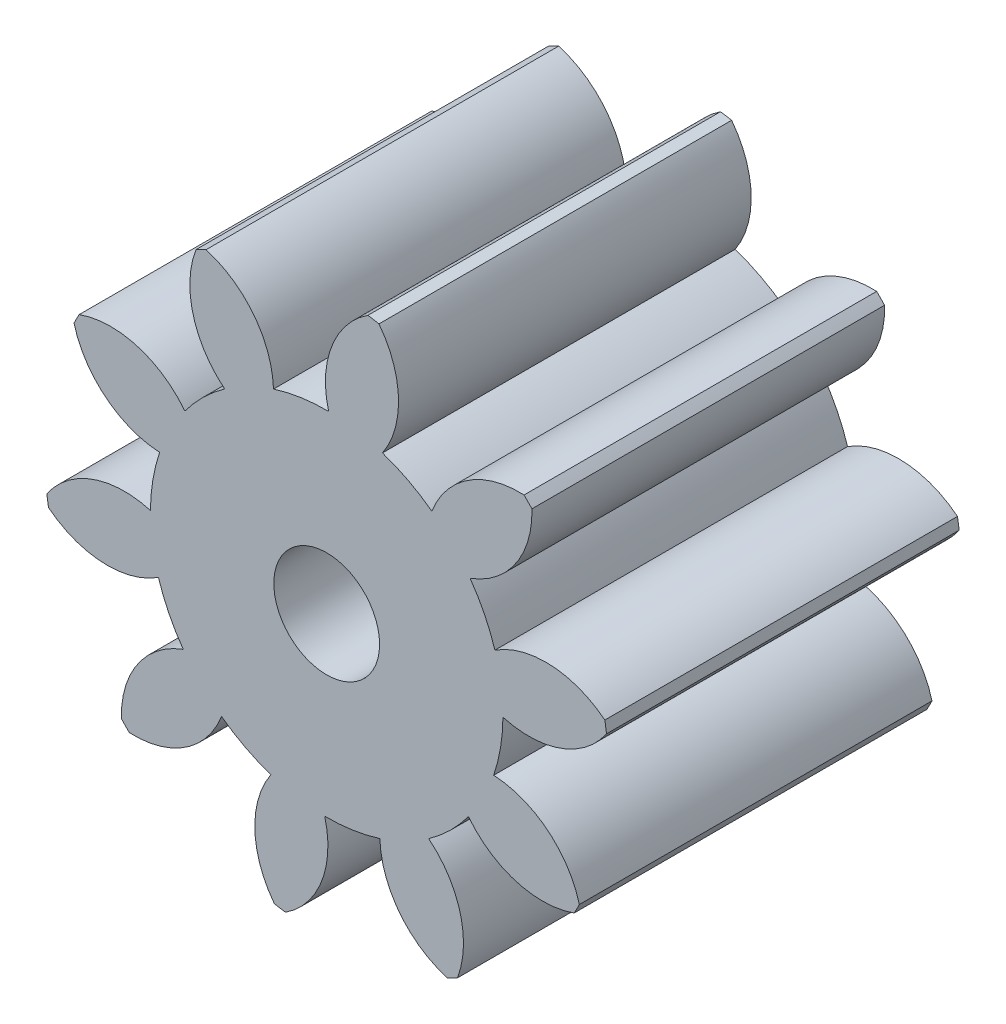
from build123d import *

# Parameters (mm, degrees)
SKETCH1_R           = 6
SKETCH1_R_2         = 0.9
BOSS_EXTRUDE1_DEPTH = 3
SKETCH2_R           = 6
CUT_EXTRUDE1_DEPTH  = 11.392304845


with BuildPart() as part:
    # Sketch1 → Boss-Extrude1 (new, symmetric)
    with BuildSketch(Plane.XY):
        Circle(SKETCH1_R)
        Circle(SKETCH1_R_2, mode=Mode.SUBTRACT)
    extrude(amount=BOSS_EXTRUDE1_DEPTH, both=True)

    # Sketch2 → Cut-Extrude1 (cut, through all)
    with BuildSketch(Plane.XY.offset(3)):
        Circle(SKETCH2_R)
        with BuildLine():
            ThreePointArc((-0.904303163, 2.859411966), (-1.23929318, 3.784776039), (-2.052505646, 4.339034521))
            ThreePointArc((-2.052505646, 4.339034521), (-2.138842368, 4.297133152), (-2.224324134, 4.253514094))
            ThreePointArc((-2.224324134, 4.253514094), (-2.272407373, 3.270556831), (-1.736096974, 2.44539737))
            ThreePointArc((-1.736096974, 2.44539737), (-2.100579038, 2.140459929), (-2.412316811, 1.781776811))
            ThreePointArc((-2.412316811, 1.781776811), (-3.227244783, 2.333509881), (-4.210932449, 2.303920118))
            ThreePointArc((-4.210932449, 2.303920118), (-4.256151318, 2.219273746), (-4.29966888, 2.133740266))
            ThreePointArc((-4.29966888, 2.133740266), (-3.760801254, 1.310248516), (-2.841900466, 0.957915832))
            ThreePointArc((-2.841900466, 0.957915832), (-2.957534919, 0.496979078), (-2.998907428, 0.023563475))
            ThreePointArc((-2.998907428, 0.023563475), (-3.982498568, -0.009077739), (-4.760926181, -0.611213463))
            ThreePointArc((-4.760926181, -0.611213463), (-4.747755125, -0.706272801), (-4.732686255, -0.801049821))
            ThreePointArc((-4.732686255, -0.801049821), (-3.812696882, -1.150530198), (-2.862194572, -0.895456995))
            ThreePointArc((-2.862194572, -0.895456995), (-2.684812984, -1.336330888), (-2.440017337, -1.743650307))
            ThreePointArc((-2.440017337, -1.743650307), (-3.216573261, -2.348197971), (-3.49240793, -3.292884275))
            ThreePointArc((-3.49240793, -3.292884275), (-3.425877845, -3.362047143), (-3.357978338, -3.429866103))
            ThreePointArc((-3.357978338, -3.429866103), (-2.408271889, -3.171845481), (-1.789227635, -2.406795685))
            ThreePointArc((-1.789227635, -2.406795685), (-1.386583742, -2.659207876), (-0.949123556, -2.844848937))
            ThreePointArc((-0.949123556, -2.844848937), (-1.222026295, -3.79038639), (-0.889908552, -4.716785215))
            ThreePointArc((-0.889908552, -4.716785215), (-0.795431669, -4.733633748), (-0.700636829, -4.74859011))
            ThreePointArc((-0.700636829, -4.74859011), (-0.083968889, -3.981623598), (-0.032836554, -2.998820228))
            ThreePointArc((-0.032836554, -2.998820228), (0.44127336, -2.966357838), (0.904303163, -2.859411966))
            ThreePointArc((0.904303163, -2.859411966), (1.23929318, -3.784776039), (2.052505646, -4.339034521))
            ThreePointArc((2.052505646, -4.339034521), (2.138842368, -4.297133152), (2.224324134, -4.253514094))
            ThreePointArc((2.224324134, -4.253514094), (2.272407373, -3.270556831), (1.736096974, -2.44539737))
            ThreePointArc((1.736096974, -2.44539737), (2.100579038, -2.140459929), (2.412316811, -1.781776811))
            ThreePointArc((2.412316811, -1.781776811), (3.227244783, -2.333509881), (4.210932449, -2.303920118))
            ThreePointArc((4.210932449, -2.303920118), (4.256151318, -2.219273746), (4.29966888, -2.133740266))
            ThreePointArc((4.29966888, -2.133740266), (3.760801254, -1.310248516), (2.841900466, -0.957915832))
            ThreePointArc((2.841900466, -0.957915832), (2.957534919, -0.496979078), (2.998907428, -0.023563475))
            ThreePointArc((2.998907428, -0.023563475), (3.982498568, 0.009077739), (4.760926181, 0.611213463))
            ThreePointArc((4.760926181, 0.611213463), (4.747755125, 0.706272801), (4.732686255, 0.801049821))
            ThreePointArc((4.732686255, 0.801049821), (3.812696882, 1.150530198), (2.862194572, 0.895456995))
            ThreePointArc((2.862194572, 0.895456995), (2.684812984, 1.336330888), (2.440017337, 1.743650307))
            ThreePointArc((2.440017337, 1.743650307), (3.216573261, 2.348197971), (3.49240793, 3.292884275))
            ThreePointArc((3.49240793, 3.292884275), (3.425877845, 3.362047143), (3.357978338, 3.429866103))
            ThreePointArc((3.357978338, 3.429866103), (2.408271889, 3.171845481), (1.789227635, 2.406795685))
            ThreePointArc((1.789227635, 2.406795685), (1.386583742, 2.659207876), (0.949123556, 2.844848937))
            ThreePointArc((0.949123556, 2.844848937), (1.222026295, 3.79038639), (0.889908552, 4.716785215))
            ThreePointArc((0.889908552, 4.716785215), (0.795431669, 4.733633748), (0.700636829, 4.74859011))
            ThreePointArc((0.700636829, 4.74859011), (0.083968889, 3.981623598), (0.032836554, 2.998820228))
            ThreePointArc((0.032836554, 2.998820228), (-0.44127336, 2.966357838), (-0.904303163, 2.859411966))
        make_face(mode=Mode.SUBTRACT)
    extrude(amount=-CUT_EXTRUDE1_DEPTH, mode=Mode.SUBTRACT)


solid = part.part
